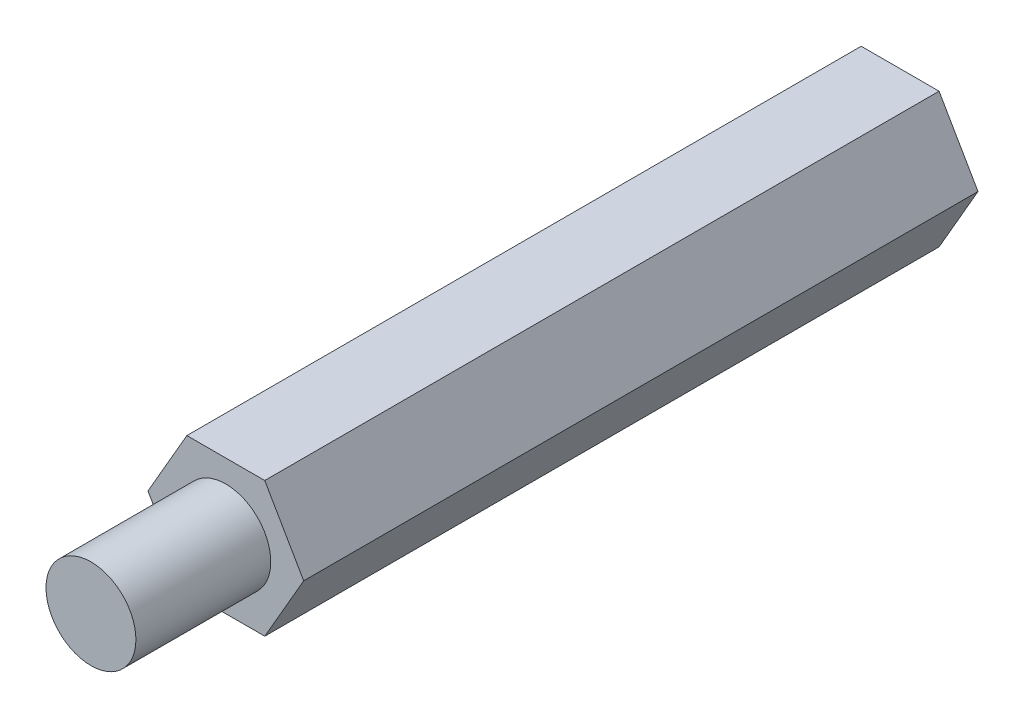
from build123d import *

# Parameters (mm, degrees)
EXTRUDE_1_DEPTH        = 30
SKETCH_2_R             = 2
EXTRUDE_2_DEPTH        = 6
HOLE_WIZARD_M4_1_D     = 3.3
HOLE_WIZARD_M4_1_DEPTH = 11.5
HOLE_WIZARD_M4_1_TIP   = 0.991420021


with BuildPart() as part:
    # 草图1 → 拉伸1 (new body)
    with BuildSketch(Plane.XY):
        Polygon((1.732050808, -3), (3.464101615, 0), (1.732050808, 3), (-1.732050808, 3), (-3.464101615, 0), (-1.732050808, -3), align=None)
    extrude(amount=EXTRUDE_1_DEPTH)

    # 草图2 → 拉伸2 (add)
    with BuildSketch(Plane.XY.offset(30)):
        with Locations(Location((0, 0, 0), (0, 0, 180))):
            Circle(SKETCH_2_R)
    extrude(amount=EXTRUDE_2_DEPTH)

    # M4 螺纹孔1
    with Locations(Plane(origin=(0, 0, 0), x_dir=(-1, 0, 0), z_dir=(0, 0, -1))):
        with Locations((0, 0)):
            Hole(HOLE_WIZARD_M4_1_D / 2, depth=HOLE_WIZARD_M4_1_DEPTH)
            with Locations((0, 0, -(HOLE_WIZARD_M4_1_DEPTH + HOLE_WIZARD_M4_1_TIP / 2))):  # 118° drill point
                Cone(0, HOLE_WIZARD_M4_1_D / 2, HOLE_WIZARD_M4_1_TIP, mode=Mode.SUBTRACT)


solid = part.part
